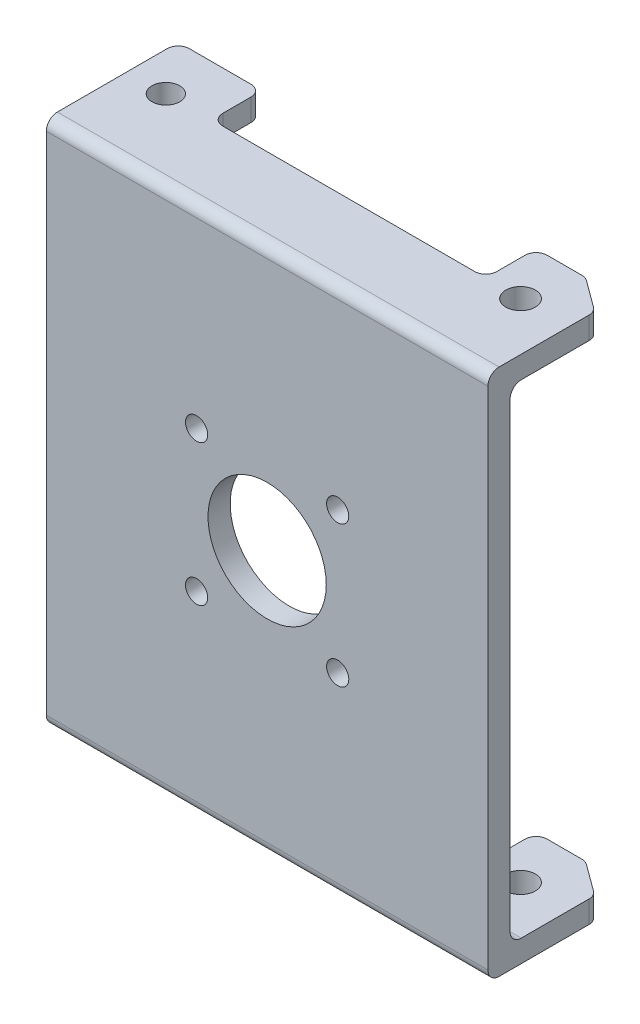
from build123d import *

# Parameters (mm, degrees)
SKETCH1_W           = 29.88
SKETCH1_H           = 35.71
SKETCH1_R           = 4
SKETCH1_R_2         = 0.75
BOSS_EXTRUDE1_DEPTH = 1.5
SKETCH2_R           = 0.94
BOSS_EXTRUDE2_DEPTH = 1.5
BOSS_EXTRUDE3_START = -1.5
SKETCH3_R           = 1
BOSS_EXTRUDE3_DEPTH = 1.5
FILLET1_R           = 0.75


with BuildPart() as part:
    # Sketch1 → Boss-Extrude1 (new body)
    with BuildSketch(Plane.XY):
        Rectangle(SKETCH1_W, SKETCH1_H)
        Circle(SKETCH1_R, mode=Mode.SUBTRACT)
        with Locations((4.772970773, 4.772970773)):
            Circle(SKETCH1_R_2, mode=Mode.SUBTRACT)
        with Locations(Location((4.772970773, -4.772970773, 0), (0, 0, 180))):
            Circle(SKETCH1_R_2, mode=Mode.SUBTRACT)
        with Locations((-4.772970773, -4.772970773)):
            Circle(SKETCH1_R_2, mode=Mode.SUBTRACT)
        with Locations(Location((-4.772970773, 4.772970773, 0), (0, 0, 180))):
            Circle(SKETCH1_R_2, mode=Mode.SUBTRACT)
    extrude(amount=BOSS_EXTRUDE1_DEPTH)

    # Sketch2 → Boss-Extrude2 (add)
    with BuildSketch(Plane(origin=(0, 17.855, 0), x_dir=(1, 0, 0), z_dir=(0, 1, 0))):
        Polygon((-14.94, 7.426000053), (-9.27, 7.426000053), (-9.27, 4.01933008), (9.27, 4.01933008), (9.27, 7.426000053), (12.62, 7.426000053), (14.94, 5.722665067), (14.94, -1.5), (-14.94, -1.5), align=None)
        with Locations(Location((-12.34, 3.986000053, 0), (0, 0, 270))):
            Circle(SKETCH2_R, mode=Mode.SUBTRACT)
        with BuildLine():
            ThreePointArc((12.66, 3.986000053), (11.66, 4.986000053), (10.66, 3.986000053))
            ThreePointArc((10.66, 3.986000053), (11.66, 2.986000053), (12.66, 3.986000053))
        make_face(mode=Mode.SUBTRACT)
    extrude(amount=-BOSS_EXTRUDE2_DEPTH)

    # Sketch3 → Boss-Extrude3 (add)
    with BuildSketch(Plane.XZ.offset(17.855).offset(BOSS_EXTRUDE3_START)):
        Polygon((-14.94, 1.5), (14.94, 1.5), (14.94, -5.722665067), (12.62, -7.426000053), (9.27, -7.426000053), (9.27, -4.01933008), (-5.44, -4.01933008), (-5.44, -7.426000053), (-14.94, -7.426000053), align=None)
        with Locations(Location((11.66, -3.986000053, 0), (0, 0, 90))):
            Circle(SKETCH3_R, mode=Mode.SUBTRACT)
        with Locations(Location((-8.34, -3.986000053, 0), (0, 0, 270))):
            Circle(SKETCH3_R, mode=Mode.SUBTRACT)
    extrude(amount=BOSS_EXTRUDE3_DEPTH)

    # Fillet1
    fillet1_edges = [part.edges().sort_by_distance(p)[0] for p in [
        (0, -17.855, 1.5),
        (-14.94, 17.105, -7.426000053),
        (-9.27, 17.105, -7.426000053),
        (-9.27, 17.105, -4.01933008),
        (9.27, 17.105, -4.01933008),
        (9.27, 17.105, -7.426000053),
        (12.62, 17.105, -7.426000053),
        (14.94, 17.105, -5.722665067),
        (0, 16.355, 0),
        (0, 17.855, 1.5),
        (0, -16.355, 0),
        (-14.94, -17.105, -7.426000053),
        (14.94, -17.105, -5.722665067),
        (12.62, -17.105, -7.426000053),
        (9.27, -17.105, -7.426000053),
        (9.27, -17.105, -4.01933008),
        (-5.44, -17.105, -4.01933008),
        (-5.44, -17.105, -7.426000053),
    ]]
    fillet(fillet1_edges, radius=FILLET1_R)


solid = part.part
